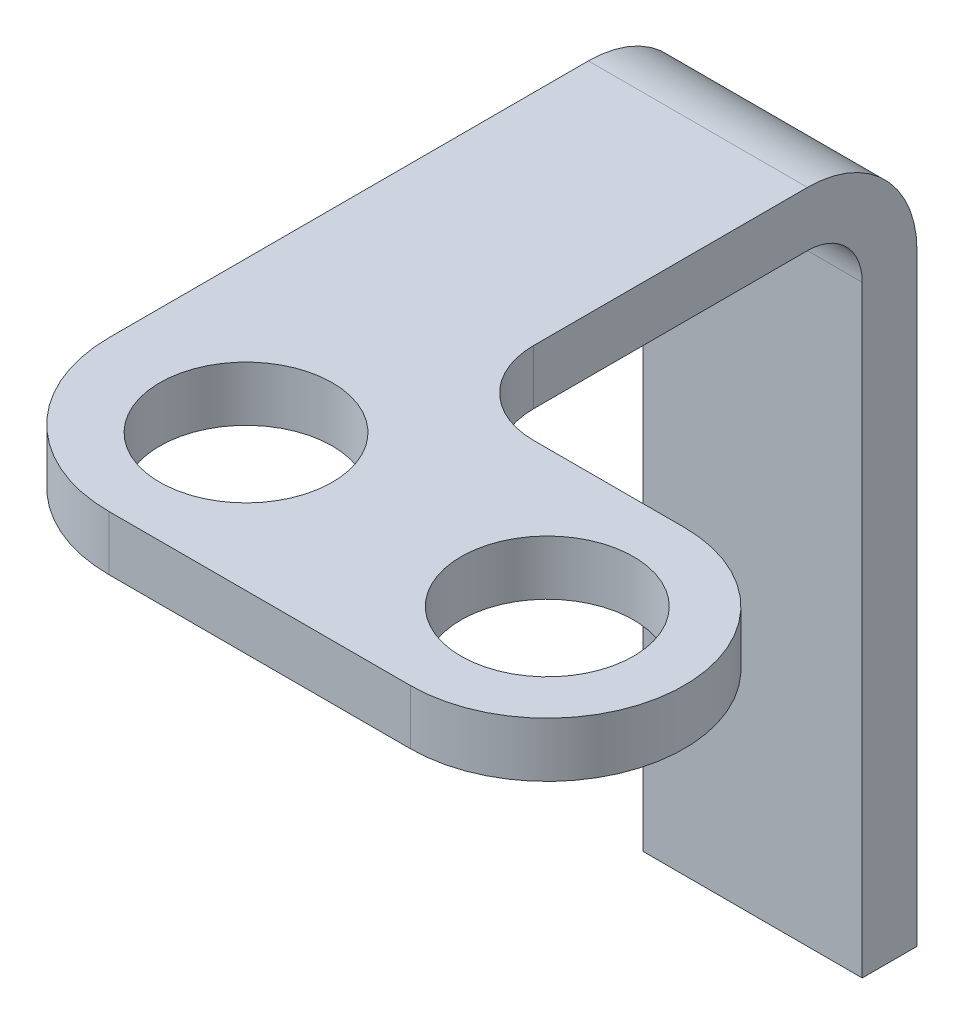
from build123d import *

# Parameters (mm, degrees)
EXTRUDE_THIN1_DEPTH = 8
CHAMFER1_SIZE       = 6
SKETCH2_R           = 3.15
BOSS_EXTRUDE1_DEPTH = 2
SKETCH3_R           = 3.15
CUT_EXTRUDE1_DEPTH  = 10.6


with BuildPart() as part:
    # Sketch1 → Extrude-Thin1 (new body)
    with BuildSketch(Plane(origin=(0, 0, 0), x_dir=(0, 0, -1), z_dir=(1, 0, 0))):
        with BuildLine():
            Line((1, -25), (1, -3))
            ThreePointArc((1, -3), (-0.171572875, -0.171572875), (-3, 1))
            Line((-3, 1), (-21, 1))
            Line((-21, 1), (-21, -1))
            Line((-21, -1), (-3, -1))
            ThreePointArc((-3, -1), (-1.585786438, -1.585786438), (-1, -3))
            Line((-1, -3), (-1, -25))
            Line((-1, -25), (1, -25))
        make_face()
    extrude(amount=EXTRUDE_THIN1_DEPTH)

    # Chamfer1
    chamfer1_edges = [part.edges().sort_by_distance(p)[0] for p in [
        (0, 0, 21),
    ]]
    chamfer(chamfer1_edges, length=CHAMFER1_SIZE)

    # Sketch2 → Boss-Extrude1 (add)
    with BuildSketch(Plane(origin=(0, 1, 0), x_dir=(1, 0, 0), z_dir=(0, 1, 0))):
        with BuildLine():
            Line((0, -20.5), (0, -3))
            Line((0, -3), (8, -13))
            ThreePointArc((8, -13), (8.878679656, -15.121320344), (11, -16))
            Line((11, -16), (16.5, -16))
            ThreePointArc((16.5, -16), (21.5, -21), (16.5, -26))
            Line((16.5, -26), (5.5, -26))
            ThreePointArc((5.5, -26), (1.610912703, -24.389087297), (0, -20.5))
        make_face()
        with Locations(Location((16.5, -21, 0), (0, 0, 270))):
            Circle(SKETCH2_R, mode=Mode.SUBTRACT)
        with Locations((5.5, -21)):
            Circle(SKETCH2_R, mode=Mode.SUBTRACT)
    extrude(amount=-BOSS_EXTRUDE1_DEPTH)

    # Sketch3 → Cut-Extrude1 (cut)
    with BuildSketch(Plane(origin=(0, 1, 0), x_dir=(1, 0, 0), z_dir=(0, 1, 0))):
        with Locations(Location((5.5, -21, 0), (0, 0, 90))):
            Circle(SKETCH3_R)
    extrude(amount=-CUT_EXTRUDE1_DEPTH, mode=Mode.SUBTRACT)


solid = part.part
